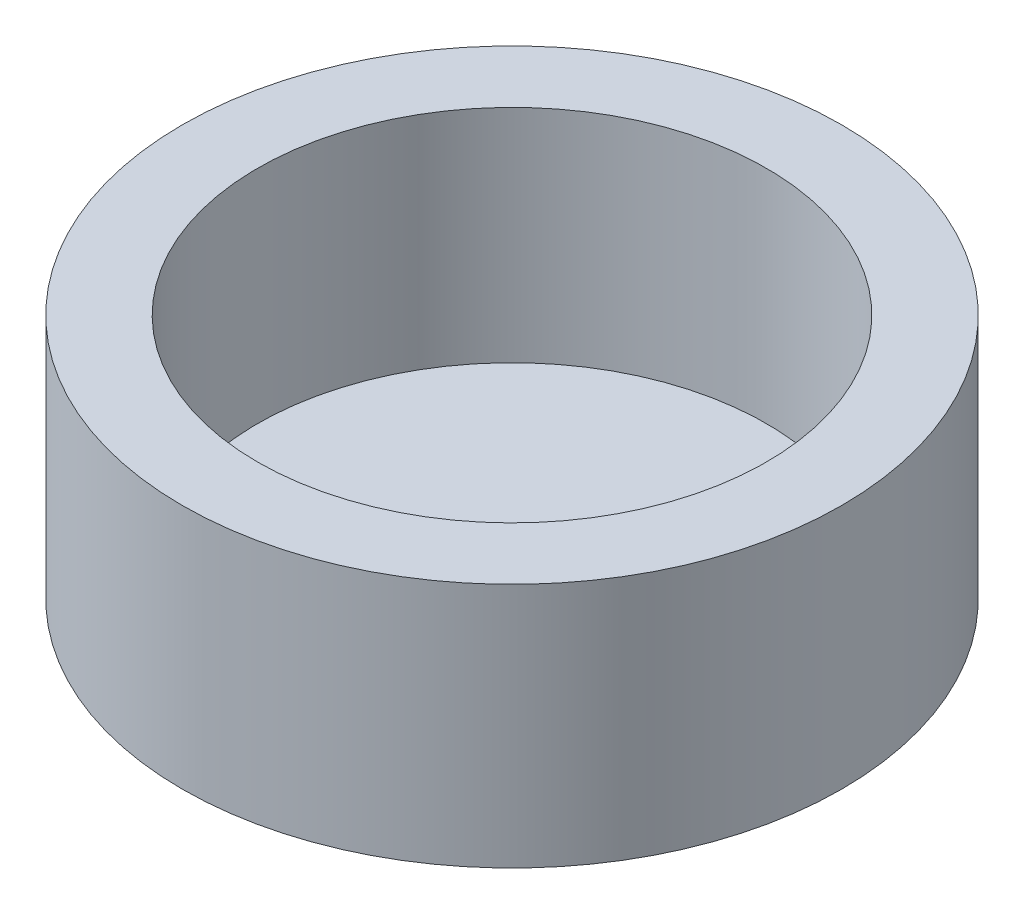
from build123d import *

# Parameters (mm, degrees)
SKETCH1_R                  = 26.836587873
DC_MOTOR_CAVITY_BASE_DEPTH = 20
SKETCH2_R                  = 20.711623291
CAVITY_DEPTH               = 18


with BuildPart() as part:
    # Sketch1 → DC Motor Cavity Base (new body)
    with BuildSketch(Plane(origin=(0, 0, 0), x_dir=(1, 0, 0), z_dir=(0, 1, 0))):
        with Locations(Location((0, 0, 0), (0, 0, 270))):
            Circle(SKETCH1_R)
    extrude(amount=DC_MOTOR_CAVITY_BASE_DEPTH)

    # Sketch2 → Cavity (cut)
    with BuildSketch(Plane(origin=(0, 20, 0), x_dir=(1, 0, 0), z_dir=(0, 1, 0))):
        with Locations(Location((0, 0, 0), (0, 0, 270))):
            Circle(SKETCH2_R)
    extrude(amount=-CAVITY_DEPTH, mode=Mode.SUBTRACT)


solid = part.part
